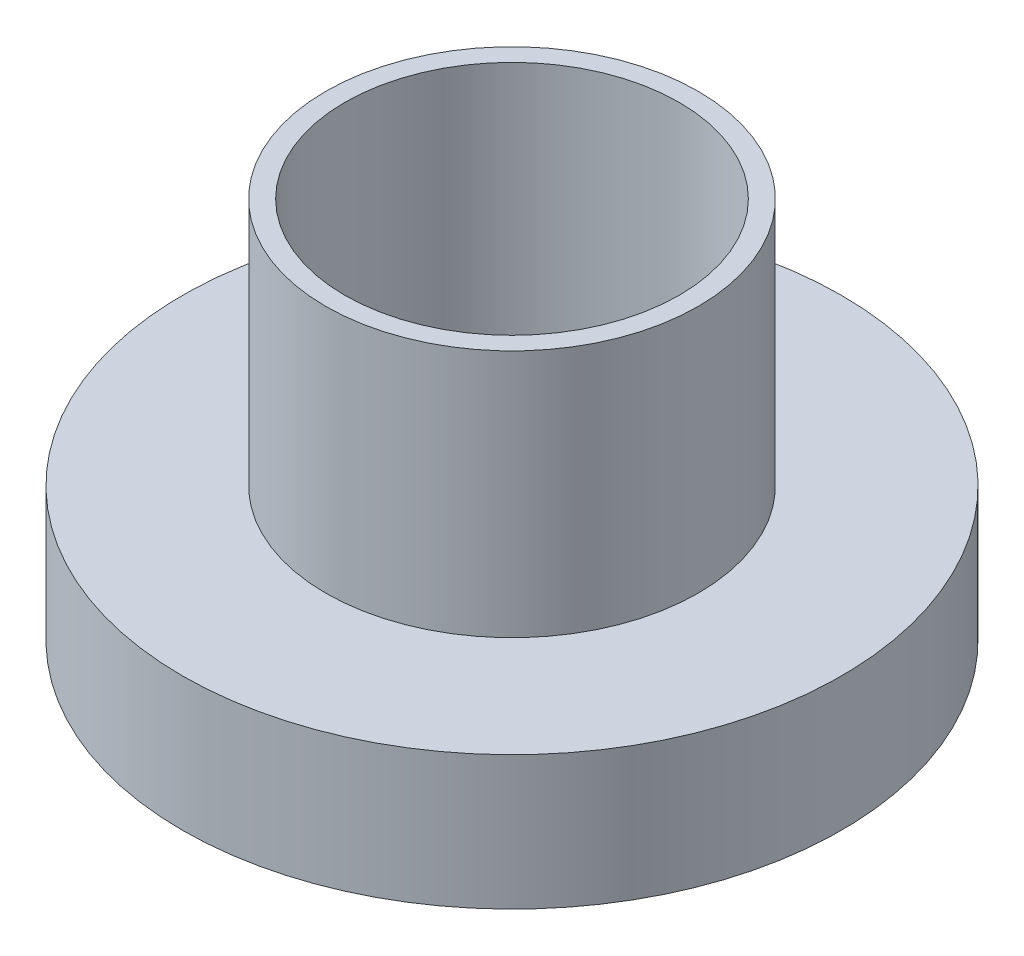
from build123d import *


with BuildPart() as part:
    # Sketch1 → Revolve1 (revolve)
    with BuildSketch(Plane.XY, mode=Mode.PRIVATE) as revolve1_sk:
        Polygon((17.5, 40), (17.5, 9.814954576), (34.5, 0), (34.5, 14), (19.5, 14), (19.5, 40), align=None)
    revolve(revolve1_sk.sketch.rotate(Axis((0, 0, 0), (0, 1, 0)), 90), axis=Axis((0, 0, 0), (0, 1, 0)))


solid = part.part
